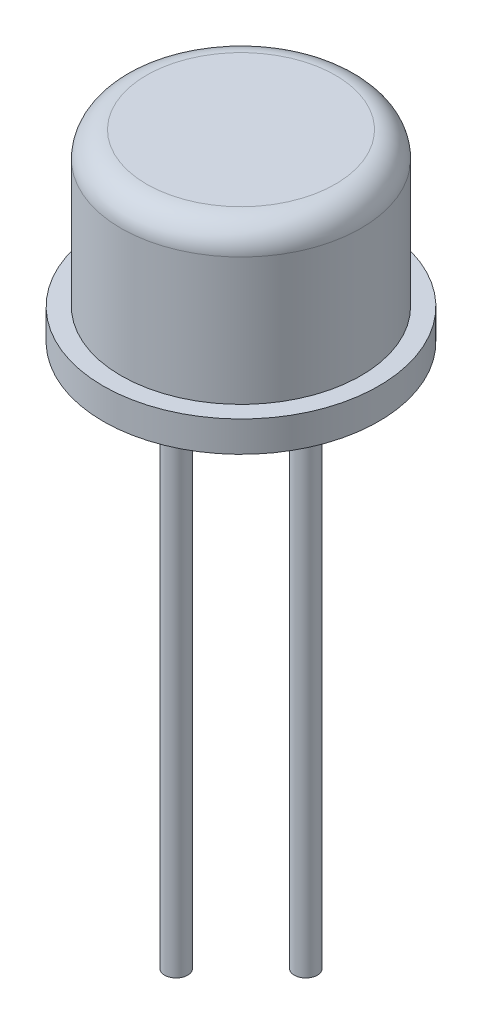
from build123d import *

# Parameters (mm, degrees)
SKETCH_1_R      = 2.7
EXTRUDE_1_DEPTH = 0.6
SKETCH_5_R      = 0.225
EXTRUDE_2_DEPTH = 10


with BuildPart() as part:
    # Эскиз1 → Бобышка-Вытянуть1 (new body)
    with BuildSketch(Plane(origin=(0, 0, 0), x_dir=(1, 0, 0), z_dir=(0, 1, 0))):
        with Locations(Location((0, 0, 0), (0, 0, 270))):
            Circle(SKETCH_1_R)
    extrude(amount=EXTRUDE_1_DEPTH)

    # Sketch 1 2 → Повернуть1 (revolve)
    with BuildSketch(Plane(origin=(0, 0.6, 0), x_dir=(-0.5248887029964605, 0.85117086972399, 0), z_dir=(0, 0, 1)), mode=Mode.PRIVATE) as revolve_1_sk:
        with BuildLine():
            Line((0, 0), (1.233488452, 2.000251544))
            Line((1.233488452, 2.000251544), (3.361415626, 0.688029786))
            ThreePointArc((3.361415626, 0.688029786), (3.585481802, 0.377802518), (3.52455671, 0))
            Line((3.52455671, 0), (2.553512609, -1.574666109))
            Line((2.553512609, -1.574666109), (0, 0))
        make_face()
    revolve(revolve_1_sk.sketch.rotate(Axis((0, 7.936864243, 0), (0, -1, 0)), 270), axis=Axis((0, 7.936864243, 0), (0, -1, 0)))

    # Эскиз5 → Бобышка-Вытянуть2 (add)
    with BuildSketch(Plane.XZ):
        with Locations(Location((1.27, 0, 0), (0, 0, 90))):
            Circle(SKETCH_5_R)
        with Locations(Location((0, 1.27, 0), (0, 0, 90))):
            Circle(SKETCH_5_R)
        with Locations(Location((0, -1.27, 0), (0, 0, 90))):
            Circle(SKETCH_5_R)
    extrude(amount=EXTRUDE_2_DEPTH)


solid = part.part
